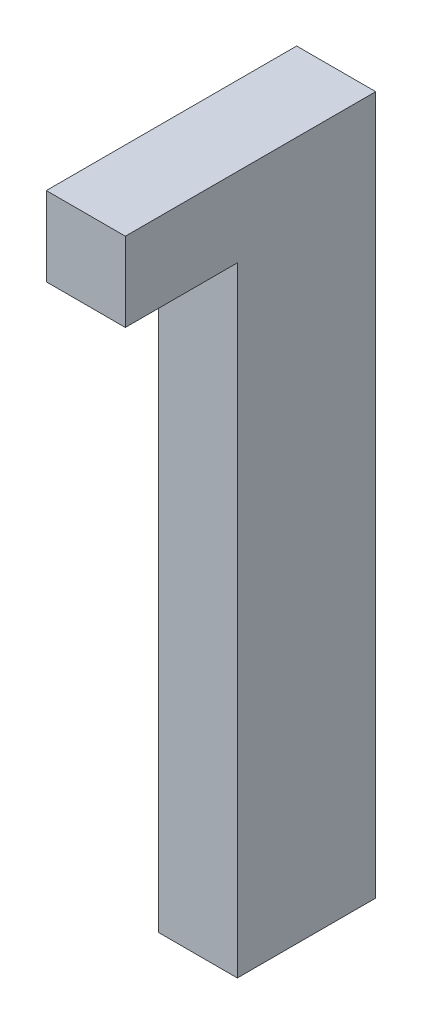
from build123d import *

# Parameters (mm, degrees)
SKETCH1_W           = 76.2
SKETCH1_H           = 241.3
BOSS_EXTRUDE2_DEPTH = 673.1
SKETCH3_W           = 107.95
SKETCH3_H           = 596.9
CUT_EXTRUDE1_DEPTH  = 127


with BuildPart() as part:
    # Sketch1 → Boss-Extrude2 (new body)
    with BuildSketch(Plane(origin=(0, 0, 0), x_dir=(1, 0, 0), z_dir=(0, 1, 0))):
        with Locations((12.980047176, 99.027762126)):
            Rectangle(SKETCH1_W, SKETCH1_H)
    extrude(amount=BOSS_EXTRUDE2_DEPTH)

    # Sketch3 → Cut-Extrude1 (cut)
    with BuildSketch(Plane(origin=(51.080047176, 0, 0), x_dir=(0, 0, -1), z_dir=(1, 0, 0))):
        with Locations((32.352762126, 298.45)):
            Rectangle(SKETCH3_W, SKETCH3_H)
    extrude(amount=-CUT_EXTRUDE1_DEPTH, mode=Mode.SUBTRACT)


solid = part.part
